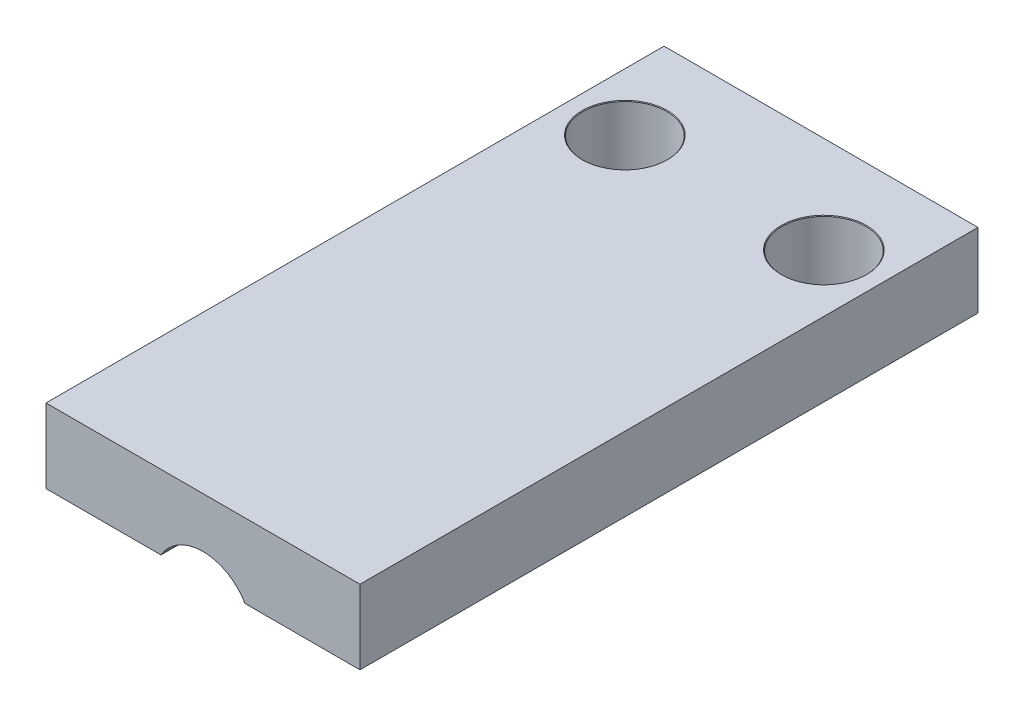
from build123d import *

# Parameters (mm, degrees)
SKETCH1_W                      = 12.7
SKETCH1_H                      = 25
BOSS_EXTRUDE1_DEPTH            = 3
CUT_EXTRUDE1_DEPTH             = 26.967720347
CUT_EXTRUDE1_DEPTH_BACK        = 17.18
M3_CLEARANCE_HOLE1_D           = 3.4
M3_CLEARANCE_HOLE1_DEPTH       = 3
M3_CLEARANCE_HOLE1_CSINK_D     = 3.45
M3_CLEARANCE_HOLE1_CSINK_ANGLE = 90
M3_CLEARANCE_HOLE1_TIP         = 1.021463052


with BuildPart() as part:
    # Sketch1 → Boss-Extrude1 (new body)
    with BuildSketch(Plane(origin=(0, 0, 0), x_dir=(1, 0, 0), z_dir=(0, 1, 0))):
        Rectangle(SKETCH1_W, SKETCH1_H)
    extrude(amount=BOSS_EXTRUDE1_DEPTH)

    # Sketch2 → Cut-Extrude1 (cut, two sides: drawn at the far end of the back side and taken through both)
    with BuildSketch(Plane.XY.offset(12.5).offset(-CUT_EXTRUDE1_DEPTH_BACK)):
        with BuildLine():
            Line((-15.481656951, -23.428816816), (-1.7, 0))
            ThreePointArc((-1.7, 0), (0, 0.972308292), (1.7, 0))
            Line((1.7, 0), (15.481656951, -23.428816816))
            Line((15.481656951, -23.428816816), (15.481656951, -77.792169389))
            Line((15.481656951, -77.792169389), (-15.481656951, -77.792169389))
            Line((-15.481656951, -77.792169389), (-15.481656951, -23.428816816))
        make_face()
    extrude(amount=CUT_EXTRUDE1_DEPTH + CUT_EXTRUDE1_DEPTH_BACK, mode=Mode.SUBTRACT)

    # M3 Clearance Hole1
    with Locations(Plane(origin=(0, 3, 0), x_dir=(1, 0, 0), z_dir=(0, 1, 0))):
        with Locations((-4.025, 8.59), (4.025, 8.59)):
            CounterSinkHole(M3_CLEARANCE_HOLE1_D / 2, M3_CLEARANCE_HOLE1_CSINK_D / 2, depth=M3_CLEARANCE_HOLE1_DEPTH, counter_sink_angle=M3_CLEARANCE_HOLE1_CSINK_ANGLE)
            with Locations((0, 0, -(M3_CLEARANCE_HOLE1_DEPTH + M3_CLEARANCE_HOLE1_TIP / 2))):  # 118° drill point
                Cone(0, M3_CLEARANCE_HOLE1_D / 2, M3_CLEARANCE_HOLE1_TIP, mode=Mode.SUBTRACT)


solid = part.part
